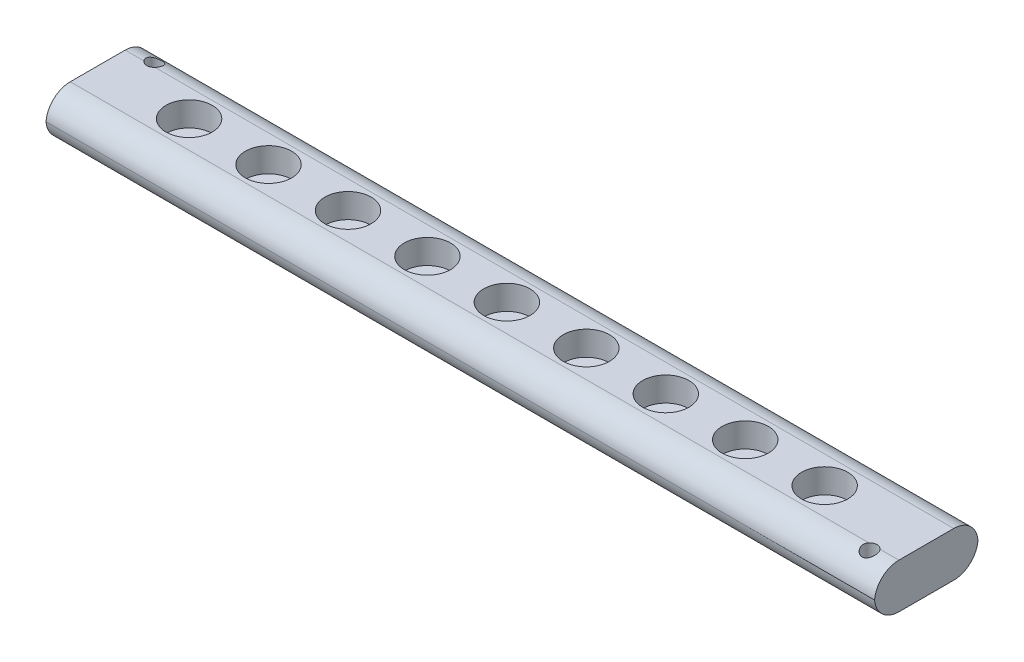
from build123d import *

# Parameters (mm, degrees)
SKETCH1_W           = 340
SKETCH1_H           = 42.5
BOSS_EXTRUDE1_DEPTH = 41.5
SKETCH2_R           = 9.5
CUT_EXTRUDE1_DEPTH  = 10
SKETCH4_R           = 3.05
CUT_EXTRUDE3_DEPTH  = 301.787476707
CUT_EXTRUDE4_DEPTH  = 344.473796902
CUT_EXTRUDE5_DEPTH  = 344.473797021
CUT_EXTRUDE6_DEPTH  = 344.473797021


with BuildPart() as part:
    # Sketch1 → Boss-Extrude1 (new body)
    with BuildSketch(Plane(origin=(0, 0, 0), x_dir=(1, 0, 0), z_dir=(0, 1, 0))):
        with Locations((126.814516129, -4.284274194)):
            Rectangle(SKETCH1_W, SKETCH1_H)
    extrude(amount=BOSS_EXTRUDE1_DEPTH)

    # Sketch2 → Cut-Extrude1 (cut)
    with BuildSketch(Plane(origin=(0, 41.5, 0), x_dir=(1, 0, 0), z_dir=(0, 1, 0))):
        with Locations(Location((-5.685483871, -4.284274194, 0), (0, 0, 270))):
            Circle(SKETCH2_R)
        with Locations(Location((26.914516129, -4.284274194, 0), (0, 0, 270))):
            Circle(SKETCH2_R)
        with Locations(Location((59.514516129, -4.284274194, 0), (0, 0, 270))):
            Circle(SKETCH2_R)
        with Locations(Location((92.114516129, -4.284274194, 0), (0, 0, 270))):
            Circle(SKETCH2_R)
        with Locations(Location((124.714516129, -4.284274194, 0), (0, 0, 270))):
            Circle(SKETCH2_R)
        with Locations(Location((157.314516129, -4.284274194, 0), (0, 0, 270))):
            Circle(SKETCH2_R)
        with Locations(Location((189.914516129, -4.284274194, 0), (0, 0, 270))):
            Circle(SKETCH2_R)
        with Locations(Location((222.514516129, -4.284274194, 0), (0, 0, 270))):
            Circle(SKETCH2_R)
        with Locations(Location((255.114516129, -4.284274194, 0), (0, 0, 270))):
            Circle(SKETCH2_R)
    extrude(amount=-CUT_EXTRUDE1_DEPTH, mode=Mode.SUBTRACT)

    # Sketch4 → Cut-Extrude3 (cut, through all)
    with BuildSketch(Plane(origin=(0, 41.5, 0), x_dir=(1, 0, 0), z_dir=(0, 1, 0))):
        with Locations(Location((286.814516129, -17.534274194, 0), (0, 0, 270))):
            Circle(SKETCH4_R)
        with Locations(Location((-33.185483871, 8.965725806, 0), (0, 0, 270))):
            Circle(SKETCH4_R)
    extrude(amount=-CUT_EXTRUDE3_DEPTH, mode=Mode.SUBTRACT)

    # Sketch3 → Cut-Extrude4 (cut, through all)
    with BuildSketch(Plane.ZY.offset(43.185483871)):
        with BuildLine():
            Line((-6.965725806, 41.5), (-16.965725806, 41.5))
            Line((-16.965725806, 41.5), (-16.965725806, 31.5))
            ThreePointArc((-16.965725806, 31.5), (-14.036793618, 38.571067812), (-6.965725806, 41.5))
        make_face()
        with BuildLine():
            ThreePointArc((-6.965725806, 0), (-14.036793618, 2.928932188), (-16.965725806, 10))
            Line((-16.965725806, 10), (-16.965725806, 0))
            Line((-16.965725806, 0), (-6.965725806, 0))
        make_face()
        with BuildLine():
            Line((25.534274194, 0), (25.534274194, 10))
            ThreePointArc((25.534274194, 10), (22.605342005, 2.928932188), (15.534274194, 0))
            Line((15.534274194, 0), (25.534274194, 0))
        make_face()
        with BuildLine():
            Line((25.534274194, 41.5), (15.534274194, 41.5))
            ThreePointArc((15.534274194, 41.5), (22.605342005, 38.571067812), (25.534274194, 31.5))
            Line((25.534274194, 31.5), (25.534274194, 41.5))
        make_face()
    extrude(amount=-CUT_EXTRUDE4_DEPTH, mode=Mode.SUBTRACT)

    # Sketch5 → Cut-Extrude5 (cut, through all)
    with BuildSketch(Plane.ZY.offset(43.185483871)):
        with BuildLine():
            Line((25.534274194, 23.1), (4.284274194, 23.1))
            Line((4.284274194, 23.1), (-16.965725806, 23.1))
            Line((-16.965725806, 23.1), (-16.965725806, 10))
            ThreePointArc((-16.965725806, 10), (-14.036793618, 2.928932188), (-6.965725806, 0))
            Line((-6.965725806, 0), (15.534274194, 0))
            ThreePointArc((15.534274194, 0), (22.605342005, 2.928932188), (25.534274194, 10))
            Line((25.534274194, 10), (25.534274194, 23.1))
        make_face()
    extrude(amount=-CUT_EXTRUDE5_DEPTH, mode=Mode.SUBTRACT)

    # Sketch6 → Cut-Extrude6 (cut, through all)
    with BuildSketch(Plane.ZY.offset(43.185483871)):
        with BuildLine():
            ThreePointArc((-16.933674442, 32.3), (-16.957709752, 31.900320899), (-16.965725806, 31.5))
            Line((-16.965725806, 31.5), (-16.965725806, 23.1))
            Line((-16.965725806, 23.1), (-6.965725806, 23.1))
            ThreePointArc((-6.965725806, 23.1), (-13.74805579, 25.751530772), (-16.933674442, 32.3))
        make_face()
        with BuildLine():
            ThreePointArc((25.502222829, 32.3), (22.316604177, 25.751530772), (15.534274194, 23.1))
            Line((15.534274194, 23.1), (25.534274194, 23.1))
            Line((25.534274194, 23.1), (25.534274194, 31.5))
            ThreePointArc((25.534274194, 31.5), (25.52625814, 31.900320899), (25.502222829, 32.3))
        make_face()
    extrude(amount=-CUT_EXTRUDE6_DEPTH, mode=Mode.SUBTRACT)


solid = part.part
